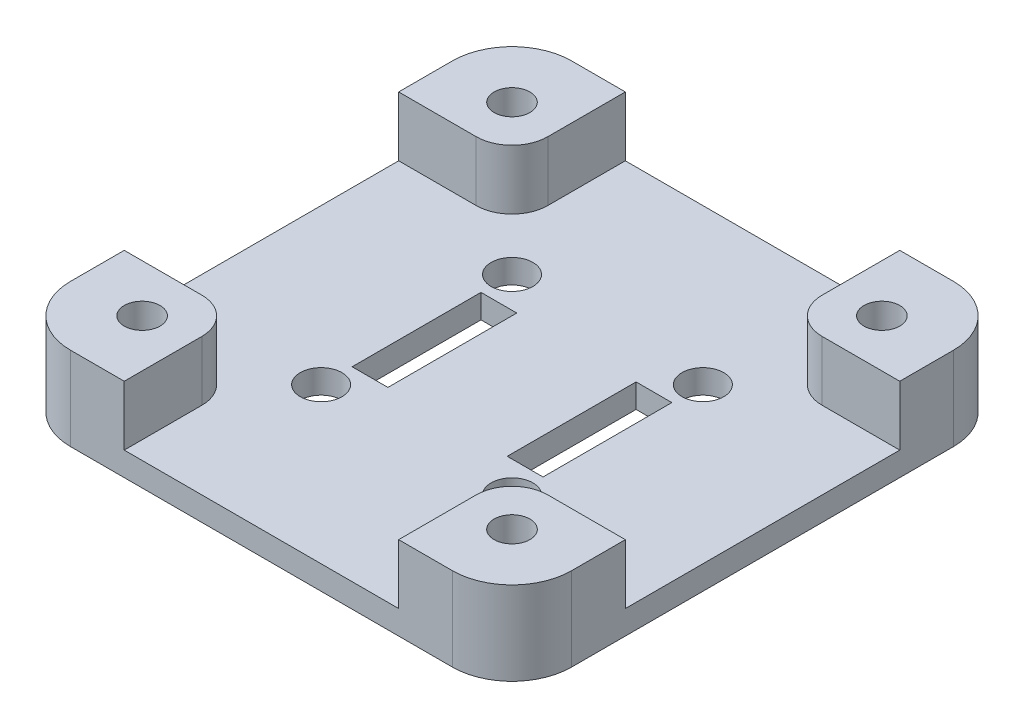
from build123d import *

# Parameters (mm, degrees)
SKETCH1_W           = 42
SKETCH1_H           = 42
SKETCH1_R           = 1.5
BOSS_EXTRUDE1_DEPTH = 7
CUT_EXTRUDE1_DEPTH  = 5
SKETCH4_R           = 1.75
CUT_EXTRUDE3_DEPTH  = 2
SKETCH5_W           = 3
SKETCH5_H           = 10.8
CUT_EXTRUDE4_DEPTH  = 4
SKETCH6_R           = 3
CUT_EXTRUDE5_DEPTH  = 3
FILLET1_R           = 5
FILLET2_R           = 3


with BuildPart() as part:
    # Sketch1 → Boss-Extrude1 (new body)
    with BuildSketch(Plane(origin=(0, 0, 0), x_dir=(1, 0, 0), z_dir=(0, 1, 0))):
        Rectangle(SKETCH1_W, SKETCH1_H)
        with Locations(Location((-15.5, 15.5, 0), (0, 0, 270))):
            Circle(SKETCH1_R, mode=Mode.SUBTRACT)
        with Locations(Location((15.5, 15.5, 0), (0, 0, 270))):
            Circle(SKETCH1_R, mode=Mode.SUBTRACT)
        with Locations(Location((-15.5, -15.5, 0), (0, 0, 270))):
            Circle(SKETCH1_R, mode=Mode.SUBTRACT)
        with Locations(Location((15.5, -15.5, 0), (0, 0, 270))):
            Circle(SKETCH1_R, mode=Mode.SUBTRACT)
    extrude(amount=BOSS_EXTRUDE1_DEPTH)

    # Sketch2 → Cut-Extrude1 (cut)
    with BuildSketch(Plane(origin=(0, 7, 0), x_dir=(1, 0, 0), z_dir=(0, 1, 0))):
        Polygon((-11.5, 11.5), (-11.5, 21), (11.5, 21), (11.5, 11.5), (21, 11.5), (21, -11.5), (11.5, -11.5), (11.5, -21), (-11.5, -21), (-11.5, -11.5), (-21, -11.5), (-21, 11.5), align=None)
    extrude(amount=-CUT_EXTRUDE1_DEPTH, mode=Mode.SUBTRACT)

    # Sketch4 → Cut-Extrude3 (cut)
    with BuildSketch(Plane(origin=(0, 2, 0), x_dir=(1, 0, 0), z_dir=(0, 1, 0))):
        with Locations(Location((8, 8, 0), (0, 0, 270))):
            Circle(SKETCH4_R)
        with Locations(Location((8, -8, 0), (0, 0, 270))):
            Circle(SKETCH4_R)
        with Locations(Location((-8, -8, 0), (0, 0, 270))):
            Circle(SKETCH4_R)
        with Locations(Location((-8, 8, 0), (0, 0, 270))):
            Circle(SKETCH4_R)
    extrude(amount=-CUT_EXTRUDE3_DEPTH, mode=Mode.SUBTRACT)

    # Sketch5 → Cut-Extrude4 (cut)
    with BuildSketch(Plane(origin=(0, 2, 0), x_dir=(1, 0, 0), z_dir=(0, 1, 0))):
        with Locations((6.5, 0)):
            Rectangle(SKETCH5_W, SKETCH5_H)
        with Locations((-6.5, 0)):
            Rectangle(SKETCH5_W, SKETCH5_H)
    extrude(amount=-CUT_EXTRUDE4_DEPTH, mode=Mode.SUBTRACT)

    # Sketch6 → Cut-Extrude5 (cut)
    with BuildSketch(Plane.XZ):
        with Locations(Location((-15.5, 15.5, 0), (0, 0, 270))):
            Circle(SKETCH6_R)
        with Locations(Location((15.5, 15.5, 0), (0, 0, 270))):
            Circle(SKETCH6_R)
        with Locations(Location((15.5, -15.5, 0), (0, 0, 270))):
            Circle(SKETCH6_R)
        with Locations(Location((-15.5, -15.5, 0), (0, 0, 270))):
            Circle(SKETCH6_R)
    extrude(amount=-CUT_EXTRUDE5_DEPTH, mode=Mode.SUBTRACT)

    # Fillet1
    fillet1_edges = [part.edges().sort_by_distance(p)[0] for p in [
        (21, 3.5, 21),
        (-21, 3.5, 21),
        (-21, 3.5, -21),
        (21, 3.5, -21),
    ]]
    fillet(fillet1_edges, radius=FILLET1_R)

    # Fillet2
    fillet2_edges = [part.edges().sort_by_distance(p)[0] for p in [
        (11.5, 4.5, 11.5),
        (-11.5, 4.5, 11.5),
        (-11.5, 4.5, -11.5),
        (11.5, 4.5, -11.5),
    ]]
    fillet(fillet2_edges, radius=FILLET2_R)


solid = part.part
